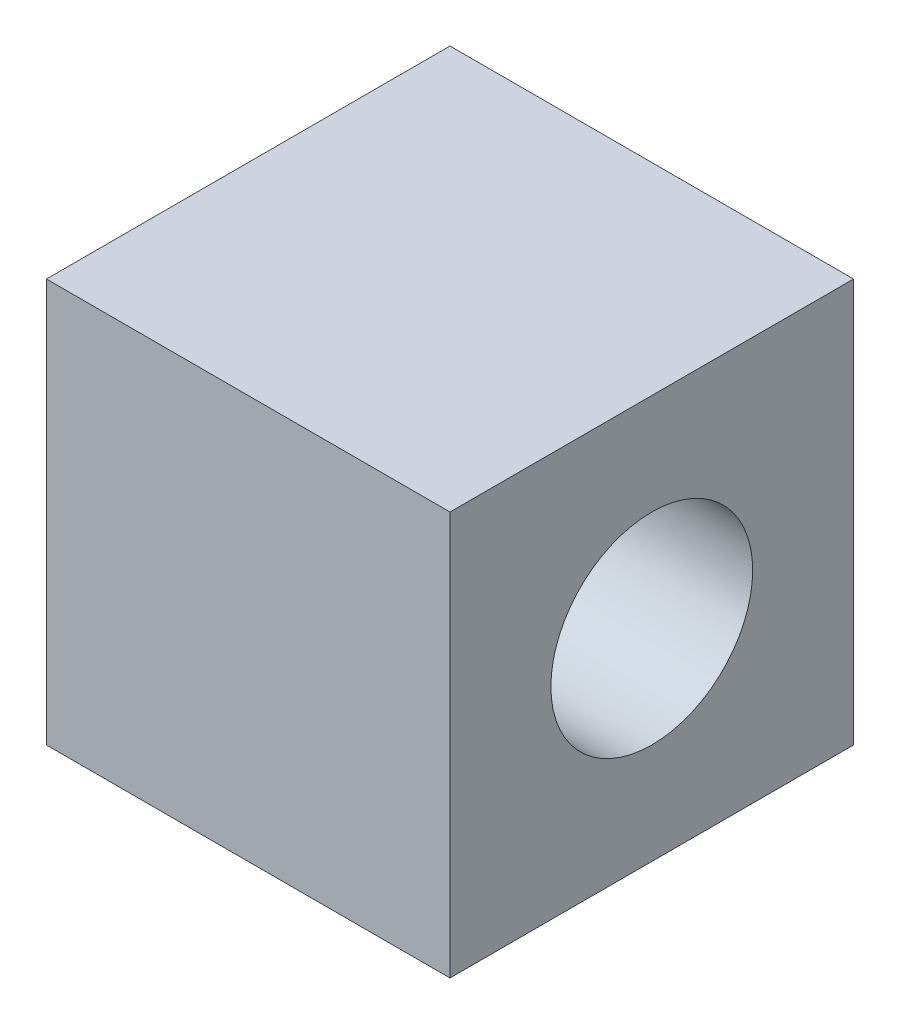
from build123d import *

# Parameters (mm, degrees)
SKETCH1_W           = 50.8
SKETCH1_H           = 50.8
BOSS_EXTRUDE1_DEPTH = 50.8
SKETCH2_R           = 12.7
CUT_EXTRUDE1_DEPTH  = 50.8


with BuildPart() as part:
    # Sketch1 → Boss-Extrude1 (new body)
    with BuildSketch(Plane.XY):
        Rectangle(SKETCH1_W, SKETCH1_H)
    extrude(amount=BOSS_EXTRUDE1_DEPTH)

    # Sketch2 → Cut-Extrude1 (cut)
    with BuildSketch(Plane(origin=(25.4, 0, 0), x_dir=(0, 0, -1), z_dir=(1, 0, 0))):
        with Locations((-25.4, 0)):
            Circle(SKETCH2_R)
    extrude(amount=-CUT_EXTRUDE1_DEPTH, mode=Mode.SUBTRACT)


solid = part.part
